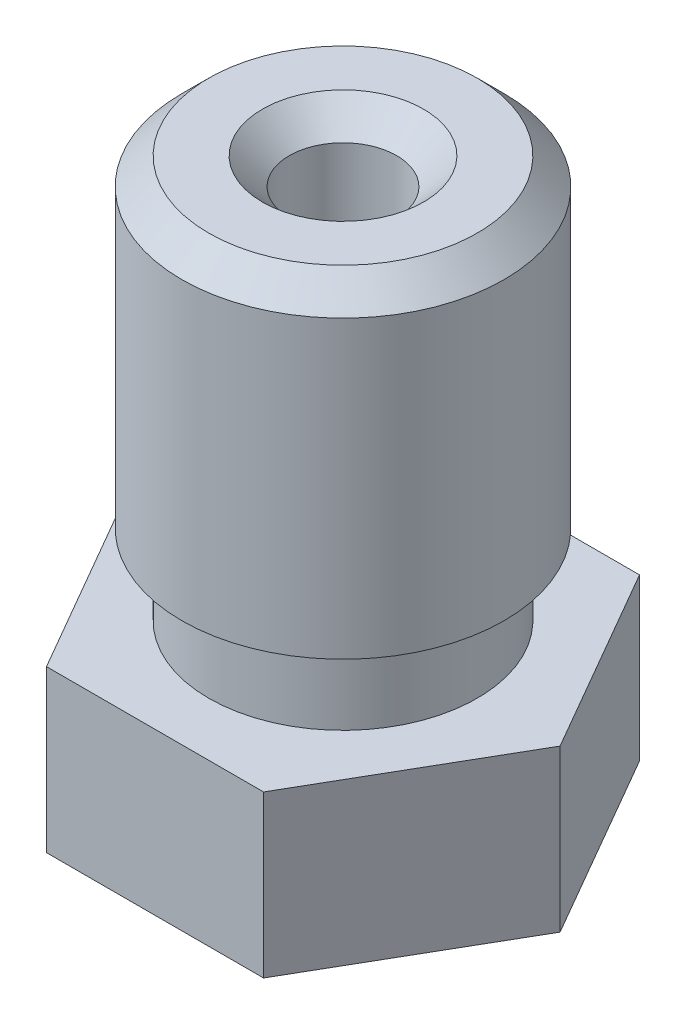
from build123d import *

# Parameters (mm, degrees)
SKETCH_1_W          = 3
SKETCH_1_H          = 6
SKETCH_2_R          = 2.5
EXTRUDE_1_DEPTH     = 1.5
EXTRUDE_2_DEPTH     = 3
SKETCH_4_R          = 2.5
EXTRUDE_3_DEPTH     = 2
EXTRUDE_3_TAPER     = 45
SKETCH_5_R          = 0.2
CUT_EXTRUDE_1_DEPTH = 0.8
SKETCH_6_R          = 0.2
CUT_EXTRUDE_2_DEPTH = 0.5
CUT_EXTRUDE_2_DRAFT = 47.726310991
SKETCH_7_R          = 0.75
CUT_EXTRUDE_3_DEPTH = 0.472727273
SKETCH_8_R          = 0.75
CUT_EXTRUDE_4_DEPTH = 0.227272727
CUT_EXTRUDE_4_DRAFT = 47.726310996
SKETCH_9_R          = 1
CUT_EXTRUDE_5_DEPTH = 10.5
CHAMFER_1_SIZE      = 0.5


with BuildPart() as part:
    # Эскиз1 → Повернуть1 (revolve)
    with BuildSketch(Plane(origin=(0, 0, 0), x_dir=(-1, 0, 0), z_dir=(0, 0, -1)), mode=Mode.PRIVATE) as revolve_1_sk:
        with Locations((-1.5, 7.5)):
            Rectangle(SKETCH_1_W, SKETCH_1_H)
    revolve(revolve_1_sk.sketch.rotate(Axis((0, 4.5, 0), (0, 1, 0)), 270), axis=Axis((0, 4.5, 0), (0, 1, 0)))

    # Эскиз2 → Бобышка-Вытянуть1 (add)
    with BuildSketch(Plane.XZ.offset(-4.5)):
        with Locations(Location((0, 0, 0), (0, 0, 270))):
            Circle(SKETCH_2_R)
    extrude(amount=EXTRUDE_1_DEPTH)

    # Эскиз3 → Бобышка-Вытянуть2 (add)
    with BuildSketch(Plane(origin=(0, 3, 0), x_dir=(1, 0, 0), z_dir=(0, 1, 0))):
        Polygon((-2.020725942, -3.5), (2.020725942, -3.5), (4.041451884, 0), (2.020725942, 3.5), (-2.020725942, 3.5), (-4.041451884, 0), align=None)
    extrude(amount=-EXTRUDE_2_DEPTH)

    # Эскиз4 → Бобышка-Вытянуть3 (add)
    with BuildSketch(Plane.XZ):
        with Locations(Location((0, 0, 0), (0, 0, 270))):
            Circle(SKETCH_4_R)
    extrude(amount=EXTRUDE_3_DEPTH, taper=EXTRUDE_3_TAPER)

    # Эскиз5 → Вырез-Вытянуть1 (cut)
    with BuildSketch(Plane.XZ.offset(2)):
        with Locations(Location((0, 0, 0), (0, 0, 90))):
            Circle(SKETCH_5_R)
    extrude(amount=-CUT_EXTRUDE_1_DEPTH, mode=Mode.SUBTRACT)


with BuildPart() as cut_extrude_2_tool:
    # Эскиз6 → Вырез-Вытянуть2 (with draft: the straight prism first)
    with BuildSketch(Plane.XZ.offset(1.2)):
        with Locations(Location((0, 0, 0), (0, 0, 90))):
            Circle(SKETCH_6_R)
    extrude(amount=-CUT_EXTRUDE_2_DEPTH)
    # Вырез-Вытянуть2: the draft: its side faces are tilted about the plane it starts from
    cut_extrude_2_sides = [cut_extrude_2_tool.faces().sort_by_distance(p)[0] for p in [
        (0, -0.95, -0.2),
    ]]
    draft(cut_extrude_2_sides, Plane.XZ.offset(1.2), CUT_EXTRUDE_2_DRAFT)


with BuildPart() as part_1:
    add(part.part)

    # Вырез-Вытянуть2: cut by cut_extrude_2_tool
    add(cut_extrude_2_tool.part, mode=Mode.SUBTRACT)

    # Эскиз7 → Вырез-Вытянуть3 (cut)
    with BuildSketch(Plane.XZ.offset(0.7)):
        with Locations(Location((0, 0, 0), (0, 0, 90))):
            Circle(SKETCH_7_R)
    extrude(amount=-CUT_EXTRUDE_3_DEPTH, mode=Mode.SUBTRACT)


with BuildPart() as cut_extrude_4_tool:
    # Эскиз8 → Вырез-Вытянуть4 (with draft: the straight prism first)
    with BuildSketch(Plane.XZ.offset(0.227272727)):
        with Locations(Location((0, 0, 0), (0, 0, 90))):
            Circle(SKETCH_8_R)
    extrude(amount=-CUT_EXTRUDE_4_DEPTH)
    # Вырез-Вытянуть4: the draft: its side faces are tilted about the plane it starts from
    cut_extrude_4_sides = [cut_extrude_4_tool.faces().sort_by_distance(p)[0] for p in [
        (0, -0.113636364, -0.75),
    ]]
    draft(cut_extrude_4_sides, Plane.XZ.offset(0.227272727), CUT_EXTRUDE_4_DRAFT)


with BuildPart() as part_2:
    add(part_1.part)

    # Вырез-Вытянуть4: cut by cut_extrude_4_tool
    add(cut_extrude_4_tool.part, mode=Mode.SUBTRACT)

    # Эскиз9 → Вырез-Вытянуть5 (cut)
    with BuildSketch(Plane(origin=(0, 10.5, 0), x_dir=(-1, 0, 0), z_dir=(0, 1, 0))):
        with Locations(Location((0, 0, 0), (0, 0, 270))):
            Circle(SKETCH_9_R)
    extrude(amount=-CUT_EXTRUDE_5_DEPTH, mode=Mode.SUBTRACT)

    # Фаска1
    chamfer_1_edges = [part_2.edges().sort_by_distance(p)[0] for p in [
        (0, 10.5, -3),
        (0, 10.5, 1),
    ]]
    chamfer(chamfer_1_edges, length=CHAMFER_1_SIZE)


solid = part_2.part
